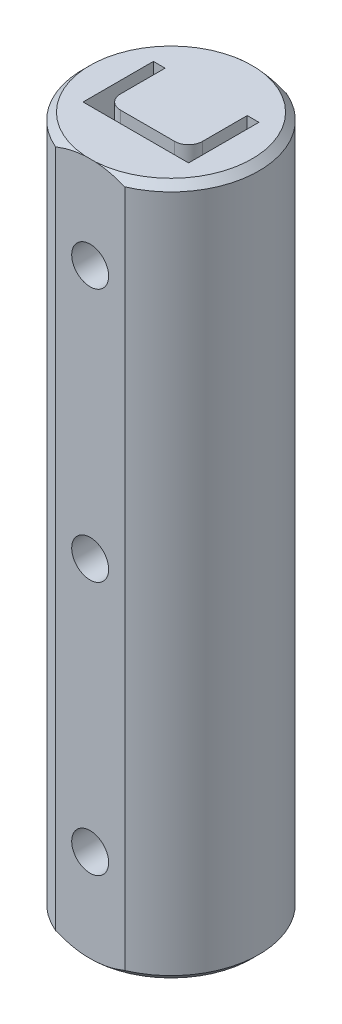
from build123d import *

# Parameters (mm, degrees)
SKETCH1_R             = 19.05
BOSS_EXTRUDE1_DEPTH   = 150
CUT_EXTRUDE1_DEPTH    = 153.400147638
FILLET1_R             = 3
CUT_EXTRUDE2_DEPTH    = 153.400147638
CHAMFER1_SIZE         = 1.5
F_8_0MM_DOWEL_HOLE1_D = 8
CUT_EXTRUDE3_REACH    = 157.208
SKETCH6_R             = 6


with BuildPart() as part:
    # Sketch1 → Boss-Extrude1 (new body)
    with BuildSketch(Plane(origin=(0, 0, 0), x_dir=(1, 0, 0), z_dir=(0, 1, 0))):
        with Locations(Location((0, 0, 0), (0, 0, 270))):
            Circle(SKETCH1_R)
    extrude(amount=BOSS_EXTRUDE1_DEPTH)

    # Sketch2 → Cut-Extrude1 (cut, through all)
    with BuildSketch(Plane(origin=(0, 150, 0), x_dir=(1, 0, 0), z_dir=(0, 1, 0))):
        Polygon((-11.43, -7.62), (11.43, -7.62), (11.43, 7.62), (8.89, 7.62), (8.89, -5.08), (-8.89, -5.08), (-8.89, 7.62), (-11.43, 7.62), align=None)
    extrude(amount=-CUT_EXTRUDE1_DEPTH, mode=Mode.SUBTRACT)

    # Fillet1
    fillet1_edges = [part.edges().sort_by_distance(p)[0] for p in [
        (-8.89, 75, 5.08),
        (8.89, 75, 5.08),
    ]]
    fillet(fillet1_edges, radius=FILLET1_R)

    # Sketch3 → Cut-Extrude2 (cut, through all)
    with BuildSketch(Plane(origin=(0, 150, 0), x_dir=(1, 0, 0), z_dir=(0, 1, 0))):
        with BuildLine():
            Line((-7.5, 17.511496224), (7.5, 17.511496224))
            ThreePointArc((7.5, 17.511496224), (0, 19.05), (-7.5, 17.511496224))
        make_face()
        with BuildLine():
            Line((-7.5, -17.511496224), (7.5, -17.511496224))
            ThreePointArc((7.5, -17.511496224), (0, -19.05), (-7.5, -17.511496224))
        make_face()
    extrude(amount=-CUT_EXTRUDE2_DEPTH, mode=Mode.SUBTRACT)

    # Chamfer1
    chamfer1_edges = [part.edges().sort_by_distance(p)[0] for p in [
        (19.05, 0, 0),
        (-19.05, 0, 0),
        (-19.05, 150, 0),
        (19.05, 150, 0),
    ]]
    chamfer(chamfer1_edges, length=CHAMFER1_SIZE)

    # Ø8.0mm Dowel Hole1 (through all)
    with Locations(Plane(origin=(0, 0, -17.511496224), x_dir=(-1, 0, 0), z_dir=(0, 0, -1))):
        with Locations((0, 130), (0, 75), (0, 20)):
            Hole(F_8_0MM_DOWEL_HOLE1_D / 2)

    # Cut-Extrude3: up to this face of the body (flat: up to its plane)
    cut_extrude3_end = Plane(part.part.faces().sort_by_distance((0, 148.482680666, 7.62))[0])
    # Sketch6 → Cut-Extrude3 (cut, up to the picked face)
    with BuildSketch(Plane(origin=(0, 0, -17.511496224), x_dir=(-1, 0, 0), z_dir=(0, 0, -1)), mode=Mode.PRIVATE) as cut_extrude3_sk1:
        with Locations((0, 130)):
            Circle(SKETCH6_R)
    cut_extrude3_tool1 = split(extrude(cut_extrude3_sk1.sketch, amount=-CUT_EXTRUDE3_REACH, mode=Mode.PRIVATE), bisect_by=cut_extrude3_end, keep=Keep.BOTH, mode=Mode.PRIVATE)
    # Sketch6 → Cut-Extrude3 (cut, up to the picked face)
    with BuildSketch(Plane(origin=(0, 0, -17.511496224), x_dir=(-1, 0, 0), z_dir=(0, 0, -1)), mode=Mode.PRIVATE) as cut_extrude3_sk2:
        with Locations((0, 75)):
            Circle(SKETCH6_R)
    cut_extrude3_tool2 = split(extrude(cut_extrude3_sk2.sketch, amount=-CUT_EXTRUDE3_REACH, mode=Mode.PRIVATE), bisect_by=cut_extrude3_end, keep=Keep.BOTH, mode=Mode.PRIVATE)
    # Sketch6 → Cut-Extrude3 (cut, up to the picked face)
    with BuildSketch(Plane(origin=(0, 0, -17.511496224), x_dir=(-1, 0, 0), z_dir=(0, 0, -1)), mode=Mode.PRIVATE) as cut_extrude3_sk3:
        with Locations((0, 20)):
            Circle(SKETCH6_R)
    cut_extrude3_tool3 = split(extrude(cut_extrude3_sk3.sketch, amount=-CUT_EXTRUDE3_REACH, mode=Mode.PRIVATE), bisect_by=cut_extrude3_end, keep=Keep.BOTH, mode=Mode.PRIVATE)
    add(cut_extrude3_tool1.solids().sort_by(Axis((0, 130, -17.511496), (0, 0, 1)))[0], mode=Mode.SUBTRACT)
    add(cut_extrude3_tool2.solids().sort_by(Axis((0, 75, -17.511496), (0, 0, 1)))[0], mode=Mode.SUBTRACT)
    add(cut_extrude3_tool3.solids().sort_by(Axis((0, 20, -17.511496), (0, 0, 1)))[0], mode=Mode.SUBTRACT)


solid = part.part
